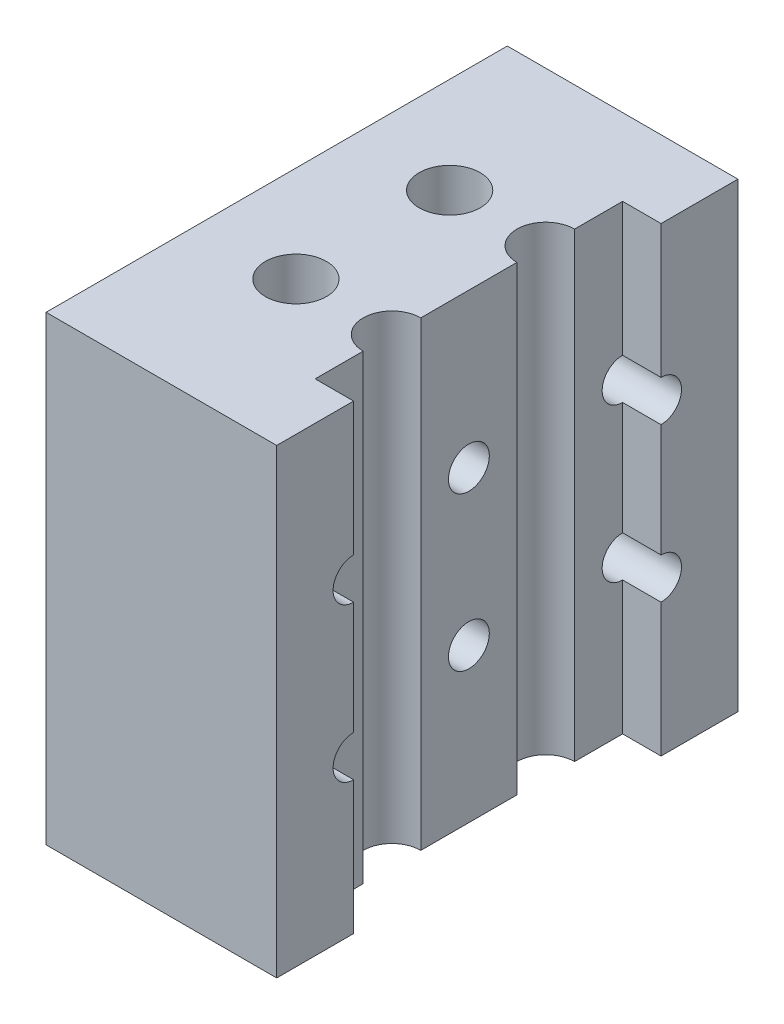
from build123d import *

# Parameters (mm, degrees)
SKETCH1_W               = 38.1
SKETCH1_H               = 76.2
BOSS_EXTRUDE1_DEPTH     = 76.2
SKETCH2_W               = 6.35
SKETCH2_H               = 50.8
CUT_EXTRUDE1_DEPTH      = 94.3255592
F_1_4_CLEARANCE_HOLE1_D = 6.7564
F_3_8_CLEARANCE_HOLE1_D = 10.0838
SKETCH7_R               = 4.7625
CUT_EXTRUDE2_DEPTH      = 94.3255592


with BuildPart() as part:
    # Sketch1 → Boss-Extrude1 (new body)
    with BuildSketch(Plane(origin=(0, 0, 0), x_dir=(1, 0, 0), z_dir=(0, 1, 0))):
        with Locations((-19.05, 0)):
            Rectangle(SKETCH1_W, SKETCH1_H)
    extrude(amount=BOSS_EXTRUDE1_DEPTH)

    # Sketch2 → Cut-Extrude1 (cut, through all)
    with BuildSketch(Plane(origin=(0, 76.2, 0), x_dir=(1, 0, 0), z_dir=(0, 1, 0))):
        with Locations((-3.175, 0)):
            Rectangle(SKETCH2_W, SKETCH2_H)
    extrude(amount=-CUT_EXTRUDE1_DEPTH, mode=Mode.SUBTRACT)

    # 1/4 Clearance Hole1 (through all)
    with Locations(Plane(origin=(0, 0, 0), x_dir=(0, 0, -1), z_dir=(1, 0, 0))):
        with Locations((0, 50.8), (0, 25.4), (-25.4, 25.4), (-25.4, 50.8), (25.4, 50.8), (25.4, 25.4)):
            Hole(F_1_4_CLEARANCE_HOLE1_D / 2)

    # 3/8 Clearance Hole1 (through all)
    with Locations(Plane(origin=(0, 76.2, 0), x_dir=(1, 0, 0), z_dir=(0, 1, 0))):
        with Locations((-22.225, -12.7), (-22.225, 12.7)):
            Hole(F_3_8_CLEARANCE_HOLE1_D / 2)

    # Sketch7 → Cut-Extrude2 (cut, through all)
    with BuildSketch(Plane(origin=(0, 76.2, 0), x_dir=(1, 0, 0), z_dir=(0, 1, 0))):
        with Locations((-6.35, 12.7)):
            Circle(SKETCH7_R)
        with Locations((-6.35, -12.7)):
            Circle(SKETCH7_R)
    extrude(amount=-CUT_EXTRUDE2_DEPTH, mode=Mode.SUBTRACT)


solid = part.part
